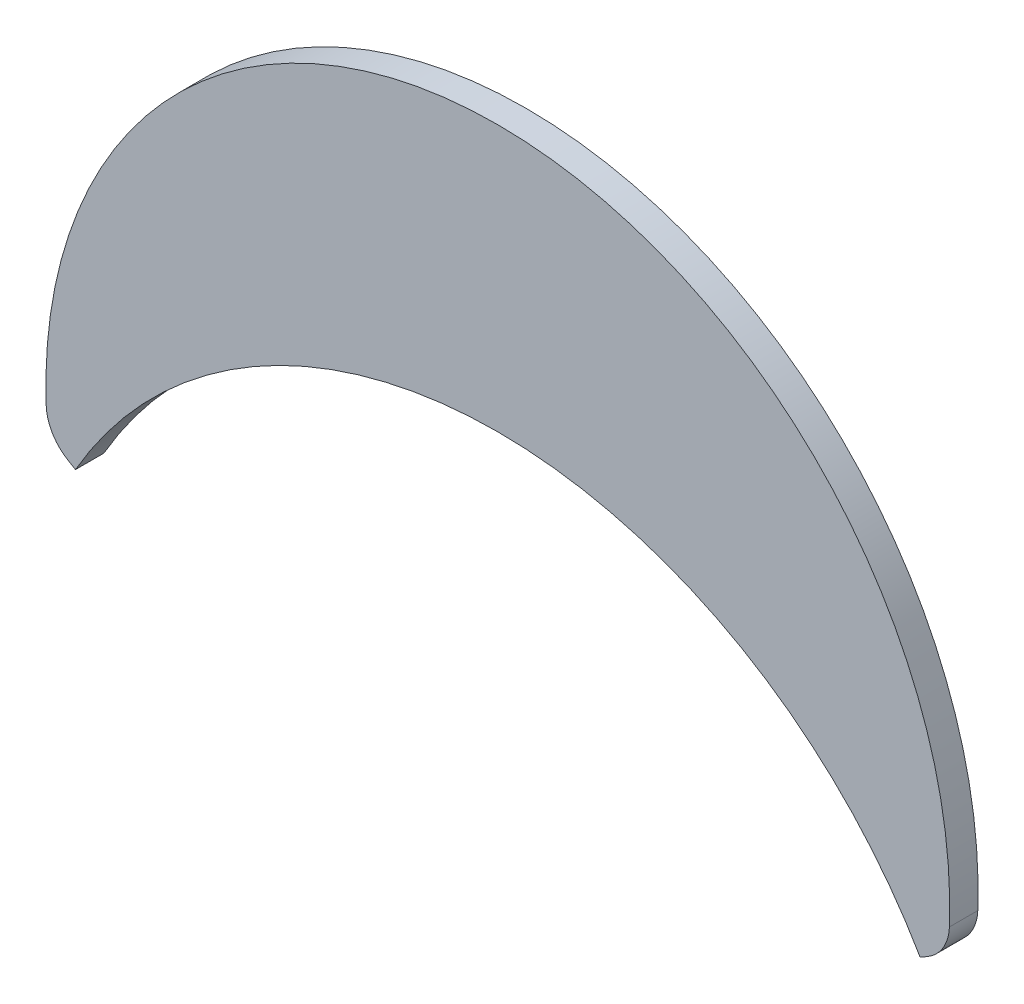
from build123d import *

# Parameters (mm, degrees)
BOSS_EXTRUDE1_DEPTH = 1.016
SKETCH2_OUTSIDE_W   = 58.782
SKETCH2_OUTSIDE_H   = 30.295
CUT_EXTRUDE1_DEPTH  = 36.715560747
FILLET1_R           = 1.5875


with BuildPart() as part:
    # Sketch1 → Boss-Extrude1 (new body)
    with BuildSketch(Plane.XY):
        with BuildLine():
            Line((-23.371860585, 13.49375), (-15.122968614, 8.73125))
            ThreePointArc((-15.122968614, 8.73125), (0, 17.4625), (15.122968614, 8.73125))
            Line((15.122968614, 8.73125), (23.371860585, 13.49375))
            ThreePointArc((23.371860585, 13.49375), (0, 26.9875), (-23.371860585, 13.49375))
        make_face()
    extrude(amount=BOSS_EXTRUDE1_DEPTH)

    # Sketch2 outside → Cut-Extrude1 (cut, through all)
    with BuildSketch(Plane.XY.offset(1.016)):
        with Locations((0, 17.8595)):
            Rectangle(SKETCH2_OUTSIDE_W, SKETCH2_OUTSIDE_H)
        with BuildLine():
            Line((-16.11283565, 9.30275), (-15.122968614, 8.73125))
            ThreePointArc((-15.122968614, 8.73125), (0, 17.4625), (15.122968614, 8.73125))
            Line((15.122968614, 8.73125), (16.11283565, 9.30275))
            ThreePointArc((16.11283565, 9.30275), (0, 26.9875), (-16.11283565, 9.30275))
        make_face(mode=Mode.SUBTRACT)
    extrude(amount=-CUT_EXTRUDE1_DEPTH, mode=Mode.SUBTRACT)

    # Fillet1
    fillet1_edges = [part.edges().sort_by_distance(p)[0] for p in [
        (16.11283565, 9.30275, 0.508),
        (-16.11283565, 9.30275, 0.508),
    ]]
    fillet(fillet1_edges, radius=FILLET1_R)


solid = part.part
